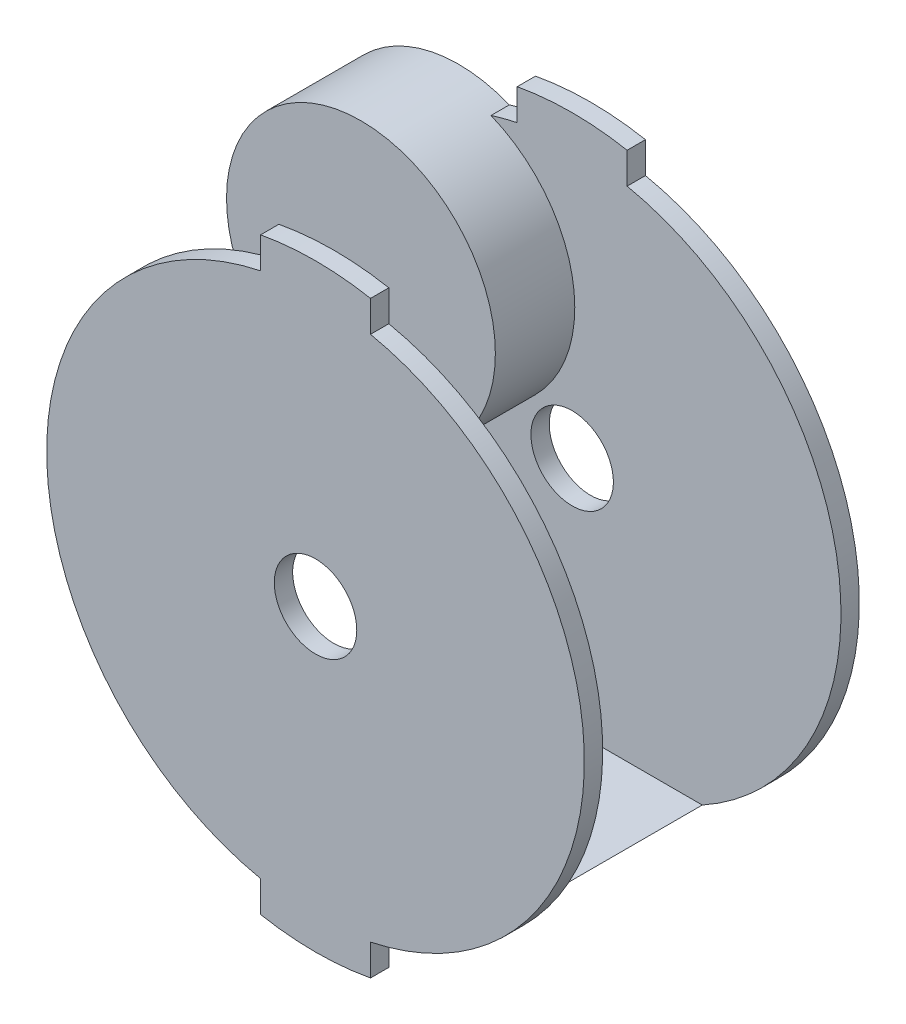
from build123d import *

# Parameters (mm, degrees)
SKETCH1_R               = 1.7145
BOSS_EXTRUDE1_DEPTH     = 11.43
SKETCH2_W               = 9.906
SKETCH2_H               = 2.54
CUT_EXTRUDE1_DEPTH      = 21.259585188
CUT_EXTRUDE1_DEPTH_BACK = 21.259585188
SKETCH4_W               = 9.906
SKETCH4_H               = 20.955
SKETCH4_H_2             = 0.635
SKETCH3_R               = 5.588
BOSS_EXTRUDE2_DEPTH     = 4.064


with BuildPart() as part:
    # Sketch1 → Boss-Extrude1 (new body)
    with BuildSketch(Plane.XY):
        with BuildLine():
            Line((-2.286, 12.234260092), (-2.286, 10.939706577))
            ThreePointArc((-2.286, 10.939706577), (-11.176, 0), (-2.286, -10.939706577))
            Line((-2.286, -10.939706577), (-2.286, -12.234260092))
            ThreePointArc((-2.286, -12.234260092), (0, -12.446), (2.286, -12.234260092))
            Line((2.286, -12.234260092), (2.286, -10.939706577))
            ThreePointArc((2.286, -10.939706577), (11.176, 0), (2.286, 10.939706577))
            Line((2.286, 10.939706577), (2.286, 12.234260092))
            ThreePointArc((2.286, 12.234260092), (0, 12.446), (-2.286, 12.234260092))
        make_face()
        Circle(SKETCH1_R, mode=Mode.SUBTRACT)
    extrude(amount=BOSS_EXTRUDE1_DEPTH)

    # Sketch2 → Cut-Revolve1 (revolve, cut)
    with BuildSketch(Plane(origin=(0, 0, 0), x_dir=(0, 0, -1), z_dir=(1, 0, 0)), mode=Mode.PRIVATE) as cut_revolve1_sk:
        with Locations((-5.715, 12.446)):
            Rectangle(SKETCH2_W, SKETCH2_H)
    revolve(cut_revolve1_sk.sketch.rotate(Axis((0, 0, 11.43), (0, 0, -1)), 348.19710831), axis=Axis((0, 0, 11.43), (0, 0, -1)), mode=Mode.SUBTRACT)

    # Sketch4 → Cut-Extrude1 (cut, two sides: drawn at the far end of the back side and taken through both)
    with BuildSketch(Plane(origin=(0, 0, 0), x_dir=(0, 0, -1), z_dir=(1, 0, 0)).offset(-CUT_EXTRUDE1_DEPTH_BACK)):
        with Locations((-5.715, 0.6985)):
            Rectangle(SKETCH4_W, SKETCH4_H)
        with Locations((-5.715, -10.8585)):
            Rectangle(SKETCH4_W, SKETCH4_H_2)
    extrude(amount=CUT_EXTRUDE1_DEPTH + CUT_EXTRUDE1_DEPTH_BACK, mode=Mode.SUBTRACT)

    # Sketch3 → Boss-Extrude2 (add)
    with BuildSketch(Plane.XY):
        with Locations(Location((-5.477956234, 5.477956234, 0), (0, 0, 202.121055782))):
            Circle(SKETCH3_R)
    extrude(amount=BOSS_EXTRUDE2_DEPTH)


solid = part.part
